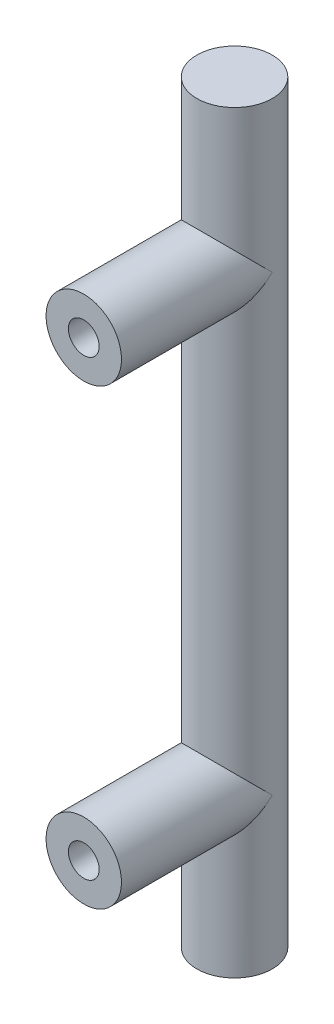
from build123d import *

# Parameters (mm, degrees)
SKETCH2_R                      = 6.35
BOSS_EXTRUDE1_DEPTH            = 127
SKETCH3_R                      = 6.35
BOSS_EXTRUDE2_DEPTH            = 25.4
F_6_0_204_DIAMETER_HOLE1_D     = 5.1816
F_6_0_204_DIAMETER_HOLE1_DEPTH = 12.7
F_6_0_204_DIAMETER_HOLE1_TIP   = 1.556709692


with BuildPart() as part:
    # Sketch2 → Boss-Extrude1 (new body)
    with BuildSketch(Plane(origin=(0, 0, 0), x_dir=(1, 0, 0), z_dir=(0, 1, 0))):
        with Locations(Location((0, 0, 0), (0, 0, 270))):
            Circle(SKETCH2_R)
    extrude(amount=BOSS_EXTRUDE1_DEPTH)

    # Sketch3 → Boss-Extrude2 (add)
    with BuildSketch(Plane.XY):
        with Locations((0, 101.646656128)):
            Circle(SKETCH3_R)
        with Locations((0, 25.353343872)):
            Circle(SKETCH3_R)
    extrude(amount=BOSS_EXTRUDE2_DEPTH)

    # #6 (0.204) Diameter Hole1
    with Locations(Plane.XY.offset(25.4)):
        with Locations((0, 101.646656128), (0, 25.353343872)):
            Hole(F_6_0_204_DIAMETER_HOLE1_D / 2, depth=F_6_0_204_DIAMETER_HOLE1_DEPTH)
            with Locations((0, 0, -(F_6_0_204_DIAMETER_HOLE1_DEPTH + F_6_0_204_DIAMETER_HOLE1_TIP / 2))):  # 118° drill point
                Cone(0, F_6_0_204_DIAMETER_HOLE1_D / 2, F_6_0_204_DIAMETER_HOLE1_TIP, mode=Mode.SUBTRACT)


solid = part.part
